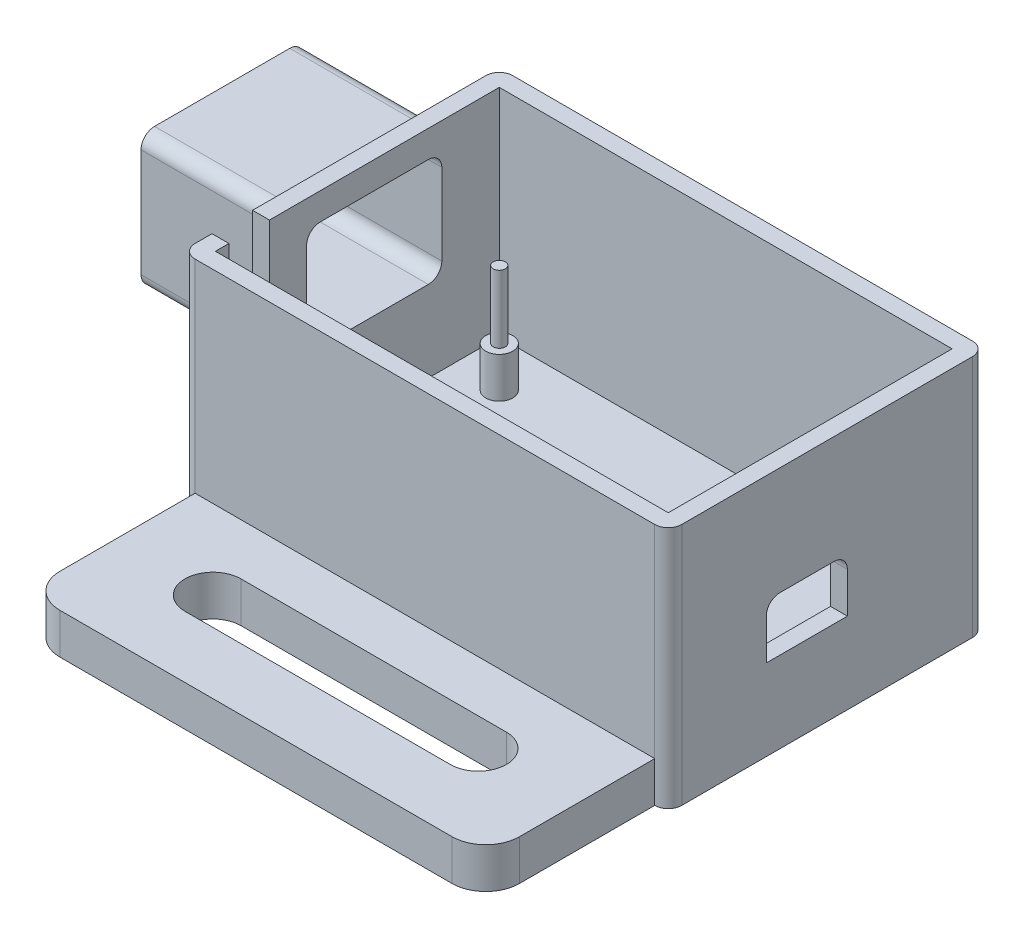
from build123d import *

# Parameters (mm, degrees)
SKETCH1_W           = 72
SKETCH1_H           = 47
BOSS_EXTRUDE1_DEPTH = 4
SKETCH3_W           = 72
SKETCH3_H           = 47
SKETCH3_W_2         = 67
SKETCH3_H_2         = 42
BOSS_EXTRUDE3_DEPTH = 32
SKETCH2_R           = 0.9
BOSS_EXTRUDE4_DEPTH = 16
SKETCH4_R           = 2
BOSS_EXTRUDE5_DEPTH = 6
SKETCH5_W           = 12
SKETCH5_H           = 8
CUT_EXTRUDE1_DEPTH  = 6
FILLET2_R           = 2
FILLET3_R           = 2
SKETCH11_W          = 24
SKETCH11_H          = 20
BOSS_EXTRUDE7_DEPTH = 20
SKETCH12_W          = 20
SKETCH12_H          = 16
CUT_EXTRUDE4_DEPTH  = 20
SKETCH13_W          = 15
SKETCH13_H          = 9
CUT_EXTRUDE5_DEPTH  = 20
FILLET4_R           = 2
FILLET5_R           = 2
SKETCH14_W          = 6
SKETCH14_H          = 25
CUT_EXTRUDE6_DEPTH  = 5
FILLET6_R           = 2
SKETCH15_W          = 68
SKETCH15_H          = 6
BOSS_EXTRUDE8_DEPTH = 25
FILLET7_R           = 5
CUT_EXTRUDE7_DEPTH  = 25


with BuildPart() as part:
    # Sketch1 → Boss-Extrude1 (new body)
    with BuildSketch(Plane(origin=(0, 0, 0), x_dir=(1, 0, 0), z_dir=(0, 1, 0))):
        with Locations((25.5, 13)):
            Rectangle(SKETCH1_W, SKETCH1_H)
    extrude(amount=BOSS_EXTRUDE1_DEPTH)

    # Sketch3 → Boss-Extrude3 (add)
    with BuildSketch(Plane(origin=(0, 4, 0), x_dir=(1, 0, 0), z_dir=(0, 1, 0))):
        with Locations((25.5, 13)):
            Rectangle(SKETCH3_W, SKETCH3_H)
        with Locations((25.5, 13)):
            Rectangle(SKETCH3_W_2, SKETCH3_H_2, mode=Mode.SUBTRACT)
    extrude(amount=BOSS_EXTRUDE3_DEPTH)

    # Sketch2 → Boss-Extrude4 (add)
    with BuildSketch(Plane(origin=(0, 4, 0), x_dir=(1, 0, 0), z_dir=(0, 1, 0))):
        with Locations(Location((-1.2, 27.2, 0), (0, 0, 270))):
            Circle(SKETCH2_R)
        with Locations(Location((-1.2, -1.2, 0), (0, 0, 90))):
            Circle(SKETCH2_R)
        with Locations(Location((52.2, -1.2, 0), (0, 0, 270))):
            Circle(SKETCH2_R)
        with Locations(Location((52.2, 27.2, 0), (0, 0, 90))):
            Circle(SKETCH2_R)
    extrude(amount=BOSS_EXTRUDE4_DEPTH)

    # Sketch4 → Boss-Extrude5 (add)
    with BuildSketch(Plane(origin=(0, 4, 0), x_dir=(1, 0, 0), z_dir=(0, 1, 0))):
        with Locations(Location((-1.2, 27.2, 0), (0, 0, 270))):
            Circle(SKETCH4_R)
        with Locations(Location((-1.2, -1.2, 0), (0, 0, 90))):
            Circle(SKETCH4_R)
        with Locations(Location((52.2, -1.2, 0), (0, 0, 270))):
            Circle(SKETCH4_R)
        with Locations(Location((52.2, 27.2, 0), (0, 0, 90))):
            Circle(SKETCH4_R)
    extrude(amount=BOSS_EXTRUDE5_DEPTH)

    # Sketch5 → Cut-Extrude1 (cut)
    with BuildSketch(Plane(origin=(61.5, 0, 0), x_dir=(0, 0, -1), z_dir=(1, 0, 0))):
        with Locations((10, 16)):
            Rectangle(SKETCH5_W, SKETCH5_H)
    extrude(amount=-CUT_EXTRUDE1_DEPTH, mode=Mode.SUBTRACT)

    # Fillet2
    fillet2_edges = [part.edges().sort_by_distance(p)[0] for p in [
        (-10.5, 18, 10.5),
        (-10.5, 18, -36.5),
        (61.5, 18, -36.5),
        (61.5, 18, 10.5),
    ]]
    fillet(fillet2_edges, radius=FILLET2_R)

    # Fillet3
    fillet3_edges = [part.edges().sort_by_distance(p)[0] for p in [
        (60.25, 20, -4),
        (60.25, 20, -16),
    ]]
    fillet(fillet3_edges, radius=FILLET3_R)

    # Sketch11 → Boss-Extrude7 (add)
    with BuildSketch(Plane.ZY.offset(10.5)):
        with Locations((-15.5, 24)):
            Rectangle(SKETCH11_W, SKETCH11_H)
    extrude(amount=BOSS_EXTRUDE7_DEPTH)

    # Sketch12 → Cut-Extrude4 (cut)
    with BuildSketch(Plane(origin=(-8, 0, 0), x_dir=(0, 0, -1), z_dir=(1, 0, 0))):
        with Locations((15.5, 24)):
            Rectangle(SKETCH12_W, SKETCH12_H)
    extrude(amount=-CUT_EXTRUDE4_DEPTH, mode=Mode.SUBTRACT)

    # Sketch13 → Cut-Extrude5 (cut)
    with BuildSketch(Plane.ZY.offset(30.5)):
        with Locations((-15.5, 24)):
            Rectangle(SKETCH13_W, SKETCH13_H)
    extrude(amount=-CUT_EXTRUDE5_DEPTH, mode=Mode.SUBTRACT)

    # Fillet4
    fillet4_edges = [part.edges().sort_by_distance(p)[0] for p in [
        (-18, 16, -25.5),
        (-18, 16, -5.5),
        (-18, 32, -5.5),
        (-18, 32, -25.5),
    ]]
    fillet(fillet4_edges, radius=FILLET4_R)

    # Fillet5
    fillet5_edges = [part.edges().sort_by_distance(p)[0] for p in [
        (-20.5, 34, -27.5),
        (-20.5, 14, -27.5),
        (-20.5, 14, -3.5),
        (-20.5, 34, -3.5),
    ]]
    fillet(fillet5_edges, radius=FILLET5_R)

    # Sketch14 → Cut-Extrude6 (cut)
    with BuildSketch(Plane.ZY.offset(10.5)):
        with Locations((3, 24.5)):
            Rectangle(SKETCH14_W, SKETCH14_H)
    extrude(amount=-CUT_EXTRUDE6_DEPTH, mode=Mode.SUBTRACT)

    # Fillet6
    fillet6_edges = [part.edges().sort_by_distance(p)[0] for p in [
        (-9.25, 12, 0),
        (-9.25, 12, 6),
    ]]
    fillet(fillet6_edges, radius=FILLET6_R)

    # Sketch15 → Boss-Extrude8 (add)
    with BuildSketch(Plane.XY.offset(10.5)):
        with Locations((25.5, 3)):
            Rectangle(SKETCH15_W, SKETCH15_H)
    extrude(amount=BOSS_EXTRUDE8_DEPTH)

    # Fillet7
    fillet7_edges = [part.edges().sort_by_distance(p)[0] for p in [
        (-8.5, 3, 35.5),
        (59.5, 3, 35.5),
    ]]
    fillet(fillet7_edges, radius=FILLET7_R)

    # Sketch16 → Cut-Extrude7 (cut)
    with BuildSketch(Plane(origin=(0, 6, 0), x_dir=(1, 0, 0), z_dir=(0, 1, 0))):
        with BuildLine():
            Line((5.870048695, -18.078882232), (45.129951305, -18.078882232))
            ThreePointArc((45.129951305, -18.078882232), (49.279951305, -22.228882232), (45.129951305, -26.378882232))
            Line((45.129951305, -26.378882232), (5.870048695, -26.378882232))
            ThreePointArc((5.870048695, -26.378882232), (1.720048695, -22.228882232), (5.870048695, -18.078882232))
        make_face()
    extrude(amount=-CUT_EXTRUDE7_DEPTH, mode=Mode.SUBTRACT)


solid = part.part
